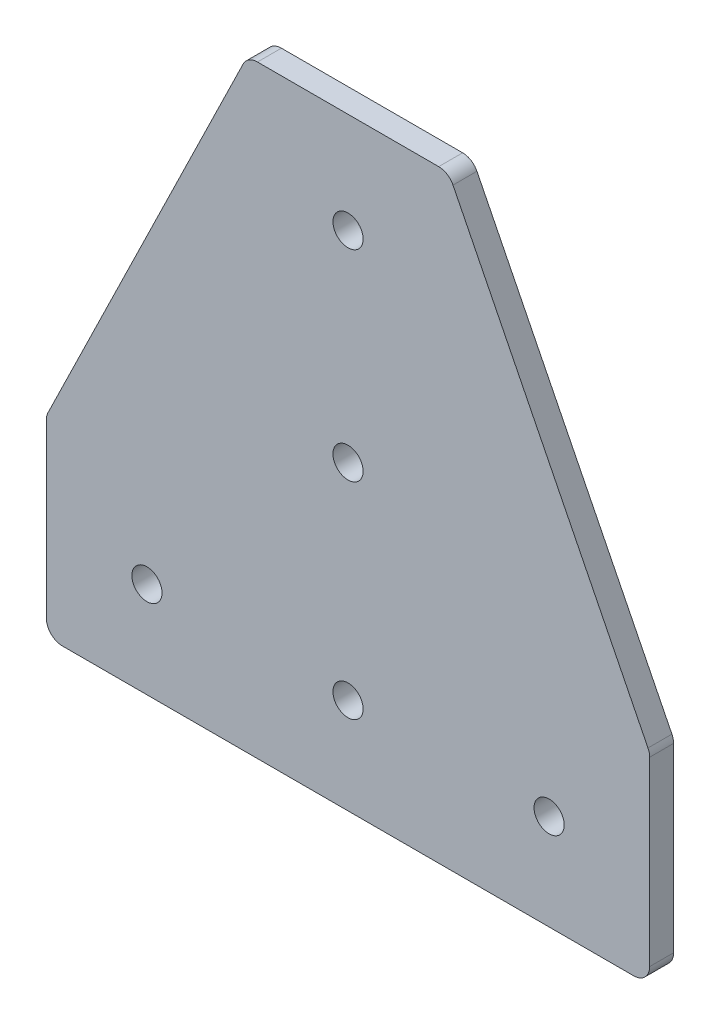
from build123d import *

# Parameters (mm, degrees)
SKETCH2_R           = 3
BOSS_EXTRUDE1_DEPTH = 4.7625
FILLET1_R           = 3.18


with BuildPart() as part:
    # Sketch2 → Boss-Extrude1 (new body)
    with BuildSketch(Plane.XY):
        Polygon((-31.10816412, 42.602538855), (8.89183588, 124.502538855), (48.89183588, 124.502538855), (88.89183588, 44.502538855), (88.89183588, 4.502538855), (-31.10816412, 4.502538855), align=None)
        with Locations(Location((28.89183588, 104.502538855, 0), (0, 0, 180))):
            Circle(SKETCH2_R, mode=Mode.SUBTRACT)
        with Locations(Location((28.89183588, 64.502538855, 0), (0, 0, 180))):
            Circle(SKETCH2_R, mode=Mode.SUBTRACT)
        with Locations(Location((-11.10816412, 23.552538855, 0), (0, 0, 180))):
            Circle(SKETCH2_R, mode=Mode.SUBTRACT)
        with Locations(Location((68.89183588, 23.552538855, 0), (0, 0, 180))):
            Circle(SKETCH2_R, mode=Mode.SUBTRACT)
        with Locations(Location((28.89183588, 23.552538855, 0), (0, 0, 180))):
            Circle(SKETCH2_R, mode=Mode.SUBTRACT)
    extrude(amount=BOSS_EXTRUDE1_DEPTH)

    # Fillet1
    fillet1_edges = [part.edges().sort_by_distance(p)[0] for p in [
        (-31.10816412, 42.602538855, 2.38125),
        (8.89183588, 124.502538855, 2.38125),
        (48.89183588, 124.502538855, 2.38125),
        (88.89183588, 44.502538855, 2.38125),
        (88.89183588, 4.502538855, 2.38125),
        (-31.10816412, 4.502538855, 2.38125),
    ]]
    fillet(fillet1_edges, radius=FILLET1_R)


solid = part.part
